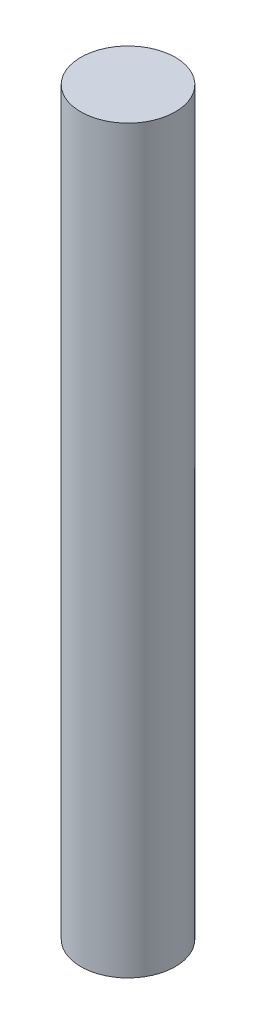
from build123d import *

# Parameters (mm, degrees)
SKETCH1_R           = 0.8
BOSS_EXTRUDE1_DEPTH = 12.53


with BuildPart() as part:
    # Sketch1 → Boss-Extrude1 (new body)
    with BuildSketch(Plane(origin=(0, 0, 0), x_dir=(1, 0, 0), z_dir=(0, 1, 0))):
        with Locations(Location((0, 0, 0), (0, 0, 90))):
            Circle(SKETCH1_R)
    extrude(amount=BOSS_EXTRUDE1_DEPTH)


solid = part.part
